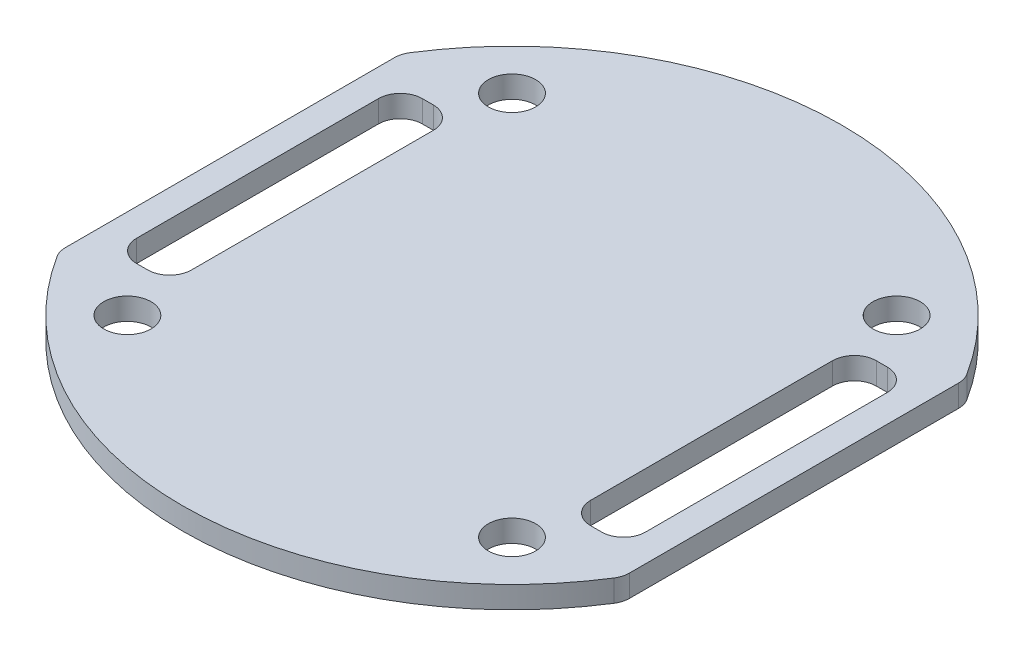
from build123d import *

# Parameters (mm, degrees)
SKETCH2_R         = 30
ACRYLICBASE_DEPTH = 1
SKETCH3_W         = 5
SKETCH3_H         = 26
WHEELS_DEPTH      = 43.473521163
SKETCH4_R         = 2.15265
HOLES_DEPTH       = 43.473521163
FLATSIDES_DEPTH   = 43.473521163
RELIEFS_R         = 2


with BuildPart() as part:
    # Sketch2 → AcrylicBase (new, symmetric)
    with BuildSketch(Plane(origin=(0, 0, 0), x_dir=(1, 0, 0), z_dir=(0, 1, 0))):
        Circle(SKETCH2_R)
    extrude(amount=ACRYLICBASE_DEPTH, both=True)

    # Sketch3 → wheels (cut, through all)
    with BuildSketch(Plane(origin=(0, 1, 0), x_dir=(1, 0, 0), z_dir=(0, 1, 0))):
        with Locations((-20.657104633, 0)):
            Rectangle(SKETCH3_W, SKETCH3_H)
        with Locations((20.657104633, 0)):
            Rectangle(SKETCH3_W, SKETCH3_H)
    extrude(amount=-WHEELS_DEPTH, mode=Mode.SUBTRACT)

    # Sketch4 → holes (cut, through all)
    with BuildSketch(Plane(origin=(0, 1, 0), x_dir=(1, 0, 0), z_dir=(0, 1, 0))):
        with Locations((-17.5, 17.5)):
            Circle(SKETCH4_R)
        with Locations((-17.5, -17.5)):
            Circle(SKETCH4_R)
        with Locations((17.5, -17.5)):
            Circle(SKETCH4_R)
        with Locations((17.5, 17.5)):
            Circle(SKETCH4_R)
    extrude(amount=-HOLES_DEPTH, mode=Mode.SUBTRACT)

    # Sketch5 → flatSides (cut, through all)
    with BuildSketch(Plane(origin=(0, 1, 0), x_dir=(1, 0, 0), z_dir=(0, 1, 0))):
        with BuildLine():
            ThreePointArc((-25.657104633, 15.547121337), (-30, 0), (-25.657104633, -15.547121337))
            Line((-25.657104633, -15.547121337), (-25.657104633, 15.547121337))
        make_face()
        with BuildLine():
            Line((25.657104633, 15.547121337), (25.657104633, -15.547121337))
            ThreePointArc((25.657104633, -15.547121337), (30, 0), (25.657104633, 15.547121337))
        make_face()
    extrude(amount=-FLATSIDES_DEPTH, mode=Mode.SUBTRACT)

    # reliefs
    reliefs_edges = [part.edges().sort_by_distance(p)[0] for p in [
        (18.157104633, 0, -13),
        (23.157104633, 0, -13),
        (23.157104633, 0, 13),
        (18.157104633, 0, 13),
        (-23.157104633, 0, 13),
        (-18.157104633, 0, 13),
        (-18.157104633, 0, -13),
        (-23.157104633, 0, -13),
        (25.657104633, 0, -15.547121337),
        (25.657104633, 0, 15.547121337),
        (-25.657104633, 0, 15.547121337),
        (-25.657104633, 0, -15.547121337),
    ]]
    fillet(reliefs_edges, radius=RELIEFS_R)


solid = part.part
